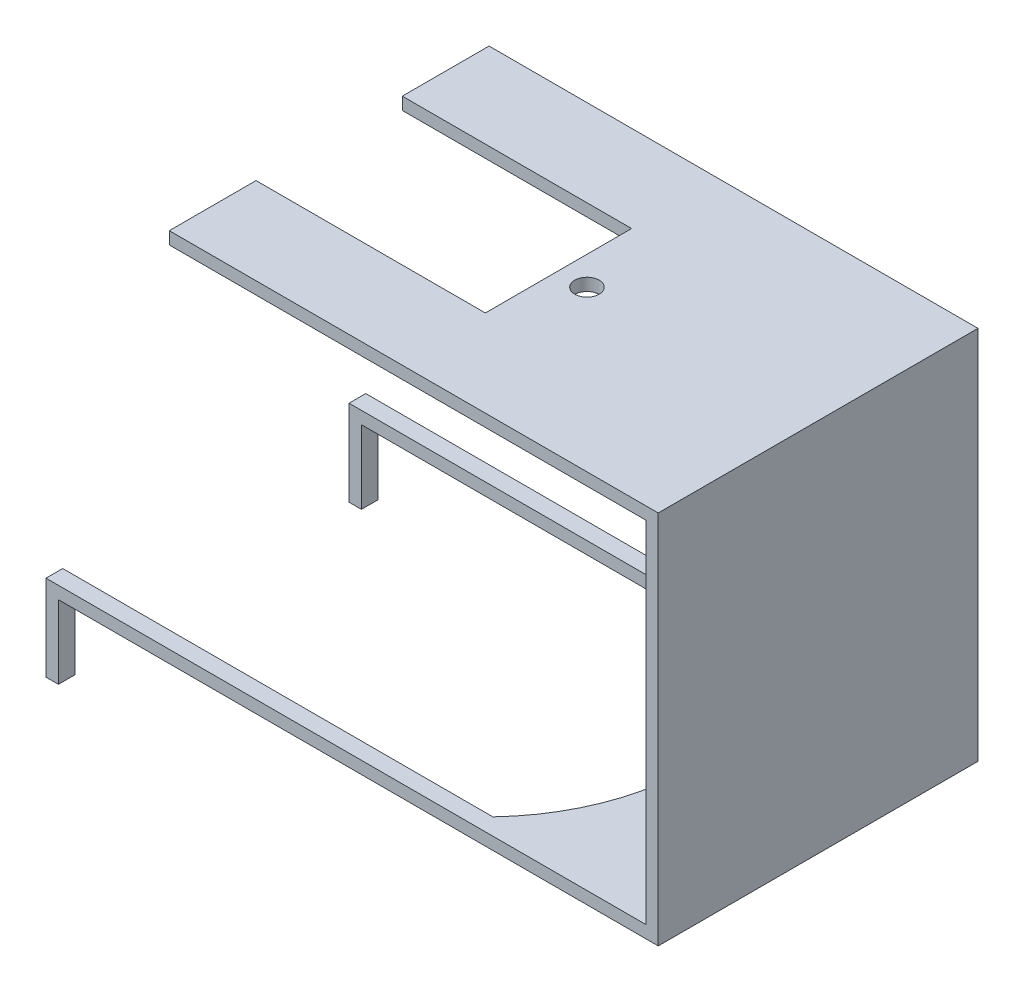
from build123d import *

# Parameters (mm, degrees)
SALIENTE_EXTRUIR1_DEPTH = 25.8
CORTAR_EXTRUIR1_REACH   = 53.135
CROQUIS2_R              = 0.986321187
CROQUIS2_W              = 18.5
CROQUIS2_H              = 11.8
CORTAR_EXTRUIR2_DEPTH   = 47.498669213


with BuildPart() as part:
    # Croquis1 → Saliente-Extruir1 (new body)
    with BuildSketch(Plane.XY):
        Polygon((-15.36468389, -0.528688711), (-15.36468389, -1.528688711), (23.08488752, -1.528688711), (23.08488752, -29.783472062), (-25.31094407, -29.783472062), (-25.31094407, -36.701823748), (-24.31094407, -36.701823748), (-24.31094407, -30.783472062), (24.08488752, -30.783472062), (24.08488752, -0.528688711), align=None)
    extrude(amount=SALIENTE_EXTRUIR1_DEPTH)

    # Croquis2 → Cortar-Extruir1 (cut, up to next)
    with BuildSketch(Plane(origin=(0, -0.528688711, 0), x_dir=(1, 0, 0), z_dir=(0, 1, 0)), mode=Mode.PRIVATE) as cortar_extruir1_sk1:
        with Locations(Location((5.43531611, -12.9, 0), (0, 0, 180))):
            Circle(CROQUIS2_R)
    cortar_extruir1_tool1 = extrude(cortar_extruir1_sk1.sketch, amount=-CORTAR_EXTRUIR1_REACH, mode=Mode.PRIVATE) & part.part
    # Croquis2 → Cortar-Extruir1 (cut, up to next)
    with BuildSketch(Plane(origin=(0, -0.528688711, 0), x_dir=(1, 0, 0), z_dir=(0, 1, 0)), mode=Mode.PRIVATE) as cortar_extruir1_sk2:
        with Locations((-6.11468389, -12.9)):
            Rectangle(CROQUIS2_W, CROQUIS2_H)
    cortar_extruir1_tool2 = extrude(cortar_extruir1_sk2.sketch, amount=-CORTAR_EXTRUIR1_REACH, mode=Mode.PRIVATE) & part.part
    add(cortar_extruir1_tool1.solids().sort_by_distance((5.435316, -0.528689, 12.9))[0], mode=Mode.SUBTRACT)
    add(cortar_extruir1_tool2.solids().sort_by_distance((-6.114684, -0.528689, 12.9))[0], mode=Mode.SUBTRACT)

    # Croquis3 → Cortar-Extruir2 (cut, through all)
    with BuildSketch(Plane(origin=(0, -29.783472062, 0), x_dir=(1, 0, 0), z_dir=(0, 1, 0))):
        with BuildLine():
            Line((-25.31094407, -1.35), (9.391397529, -1.35))
            ThreePointArc((9.391397529, -1.35), (13.99905593, -12.9), (9.391397529, -24.45))
            Line((9.391397529, -24.45), (-25.31094407, -24.45))
            Line((-25.31094407, -24.45), (-25.31094407, -1.35))
        make_face()
    extrude(amount=-CORTAR_EXTRUIR2_DEPTH, mode=Mode.SUBTRACT)


solid = part.part
